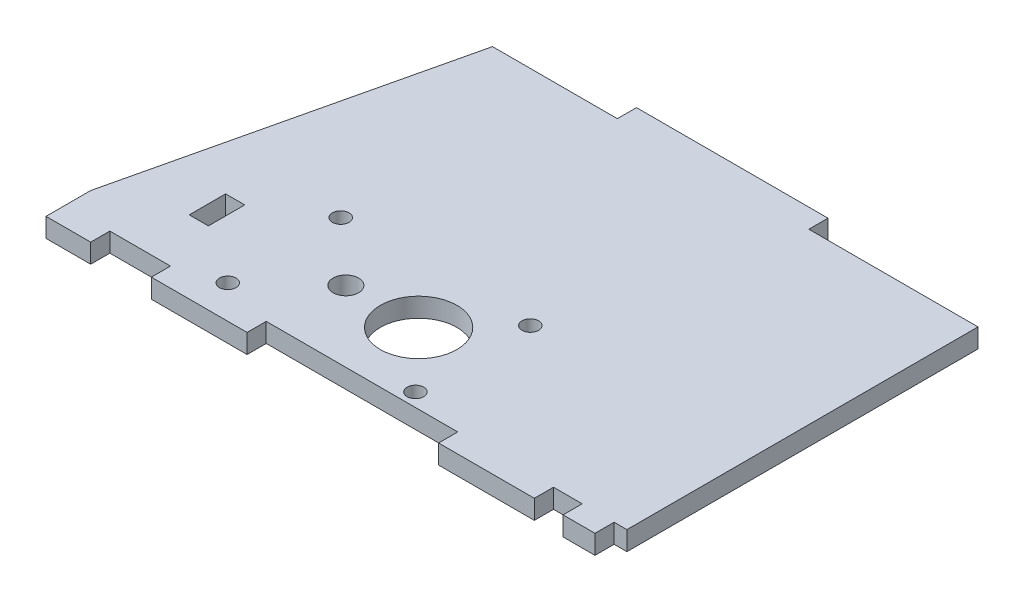
from build123d import *

# Parameters (mm, degrees)
SKETCH1_R           = 2
SKETCH1_R_2         = 6
SKETCH1_R_3         = 1.3
SKETCH1_W           = 3
SKETCH1_H           = 5.696795919
BOSS_EXTRUDE1_DEPTH = 3


with BuildPart() as part:
    # Sketch1 → Boss-Extrude1 (new body)
    with BuildSketch(Plane(origin=(0, 0, 0), x_dir=(1, 0, 0), z_dir=(0, 1, 0))):
        Polygon((-95.740581995, 27.853387647), (-80.740581995, 27.853387647), (-80.740581995, 30.853387647), (-50.740581995, 30.853387647), (-50.740581995, 27.853387647), (-35.740581995, 27.853387647), (-26.240581995, 27.853387647), (-24.240581995, 27.853387647), (-24.240581995, -27.146612353), (-26.240581995, -27.146612353), (-26.240581995, -30.146612353), (-31.240581995, -30.146612353), (-31.240581995, -27.146612353), (-35.740581995, -27.146612353), (-35.740581995, -30.146612353), (-50.740581995, -30.146612353), (-50.740581995, -27.146612353), (-80.740581995, -27.146612353), (-80.740581995, -30.146612353), (-95.740581995, -30.146612353), (-95.740581995, -27.146612353), (-105.240581995, -27.146612353), (-105.240581995, -30.146612353), (-112.240581995, -30.146612353), (-112.240581995, -27.146612353), (-112.240581995, -23.146612353), (-100.290581995, 27.853387647), align=None)
        with Locations(Location((-79.383372271, -16.032348928, 0), (0, 0, 270))):
            Circle(SKETCH1_R, mode=Mode.SUBTRACT)
        with Locations(Location((-67.983372271, -16.032348928, 0), (0, 0, 270))):
            Circle(SKETCH1_R_2, mode=Mode.SUBTRACT)
        with Locations(Location((-59.483372271, -25.032348928, 0), (0, 0, 270))):
            Circle(SKETCH1_R_3, mode=Mode.SUBTRACT)
        with Locations(Location((-59.483372271, -7.032348928, 0), (0, 0, 270))):
            Circle(SKETCH1_R_3, mode=Mode.SUBTRACT)
        with Locations(Location((-88.98337227, -7.23234893, 0), (0, 0, 270))):
            Circle(SKETCH1_R_3, mode=Mode.SUBTRACT)
        with Locations(Location((-88.98337227, -24.93234893, 0), (0, 0, 270))):
            Circle(SKETCH1_R_3, mode=Mode.SUBTRACT)
        with Locations((-99.720235087, -15.880746888)):
            Rectangle(SKETCH1_W, SKETCH1_H, mode=Mode.SUBTRACT)
    extrude(amount=BOSS_EXTRUDE1_DEPTH)


solid = part.part
